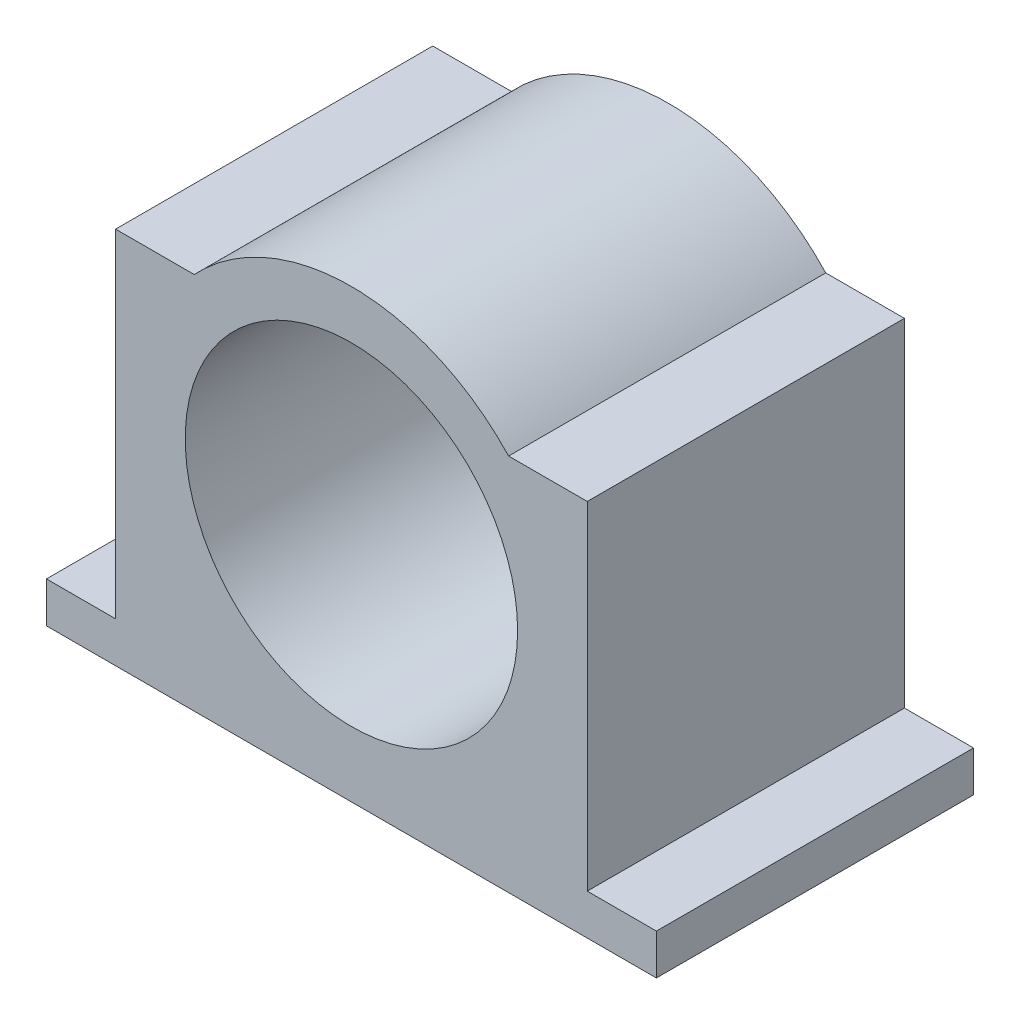
from build123d import *

# Parameters (mm, degrees)
ESQUISSE1_R        = 40.871997607
BOSS_EXTRU_1_DEPTH = 78


with BuildPart() as part:
    # Esquisse1 → Boss.-Extru.1 (new body)
    with BuildSketch(Plane.XY):
        with BuildLine():
            Line((0, 0), (150, 0))
            Line((150, 0), (150, 9.997713951))
            Line((150, 9.997713951), (133, 9.997713951))
            Line((133, 9.997713951), (133, 92.997713951))
            Line((133, 92.997713951), (113.65278798, 92.997713951))
            ThreePointArc((113.65278798, 92.997713951), (75.001563552, 109.79464934), (36.349345741, 93))
            Line((36.349345741, 93), (17, 93))
            Line((17, 93), (17, 10))
            Line((17, 10), (0, 10))
            Line((0, 10), (0, 0))
        make_face()
        with Locations((75, 56.922651756)):
            Circle(ESQUISSE1_R, mode=Mode.SUBTRACT)
    extrude(amount=BOSS_EXTRU_1_DEPTH)


solid = part.part
